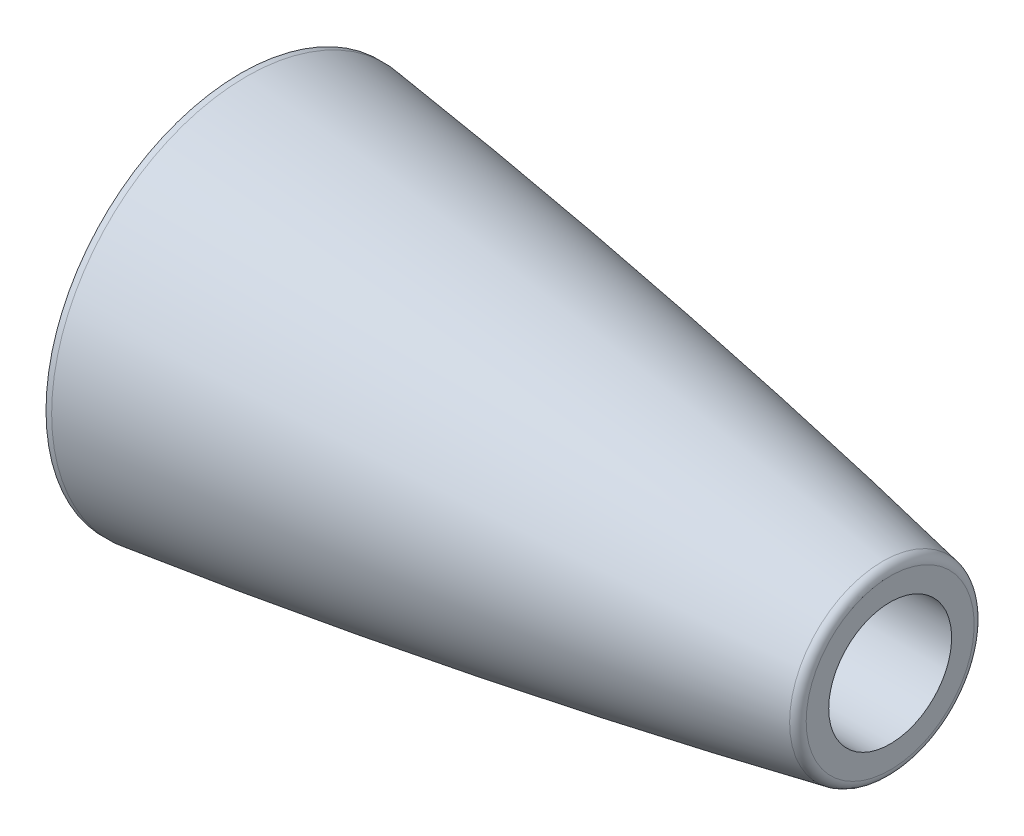
from build123d import *


with BuildPart() as part:
    # Esboço1 → Revolução1 (revolve)
    with BuildSketch(Plane.XY, mode=Mode.PRIVATE) as revolu_o1_sk:
        with BuildLine():
            Line((10.25, 1.665004796), (10.25, 1.325))
            Line((10.25, 1.325), (14, 1.325))
            Line((14, 1.325), (14, 1.810751674))
            ThreePointArc((14, 1.810751674), (13.954531856, 1.937715864), (13.838800945, 2.006951793))
            ThreePointArc((13.838800945, 2.006951793), (7.000290487, 3.229378761), (0.121522619, 4.2))
            Line((0.121522619, 4.2), (0, 4.2))
            Line((0, 4.2), (0, 3.207411337))
            Line((0, 3.207411337), (3.76708994, 3.001987913))
            Line((3.76708994, 3.001987913), (10.25, 1.665004796))
        make_face()
    revolve(revolu_o1_sk.sketch.rotate(Axis((0, 0, 0), (1, 0, 0)), 90), axis=Axis((0, 0, 0), (1, 0, 0)))


solid = part.part
